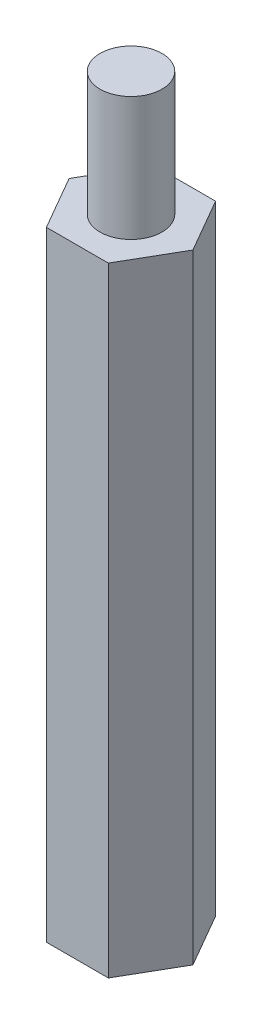
from build123d import *

# Parameters (mm, degrees)
EXTRUDE_1_DEPTH      = 30
HOLE_WIZARD_M3_1_D   = 2.5
EXTRUDE_3_DEPTH      = 6
EXTRUDE_3_DEPTH_BACK = 5
SKETCH_4_R           = 1.5


with BuildPart() as part:
    # 草图1 → 凸台-拉伸1 (new body)
    with BuildSketch(Plane(origin=(0, 0, 0), x_dir=(1, 0, 0), z_dir=(0, 1, 0))):
        Polygon((1.5, 2.598076211), (-1.5, 2.598076211), (-3, 0), (-1.5, -2.598076211), (1.5, -2.598076211), (3, 0), align=None)
    extrude(amount=EXTRUDE_1_DEPTH)

    # M3 螺纹孔1 (through all)
    with Locations(Plane(origin=(0, 30, 0), x_dir=(1, 0, 0), z_dir=(0, 1, 0))):
        with Locations((0, 0)):
            Hole(HOLE_WIZARD_M3_1_D / 2)

    # 草图4 → 凸台-拉伸3 (add, two sides: drawn at the far end of the back side and taken through both)
    with BuildSketch(Plane(origin=(0, 30, 0), x_dir=(1, 0, 0), z_dir=(0, 1, 0)).offset(-EXTRUDE_3_DEPTH_BACK)):
        with Locations(Location((0, 0, 0), (0, 0, 270))):
            Circle(SKETCH_4_R)
    extrude(amount=EXTRUDE_3_DEPTH + EXTRUDE_3_DEPTH_BACK)


solid = part.part
